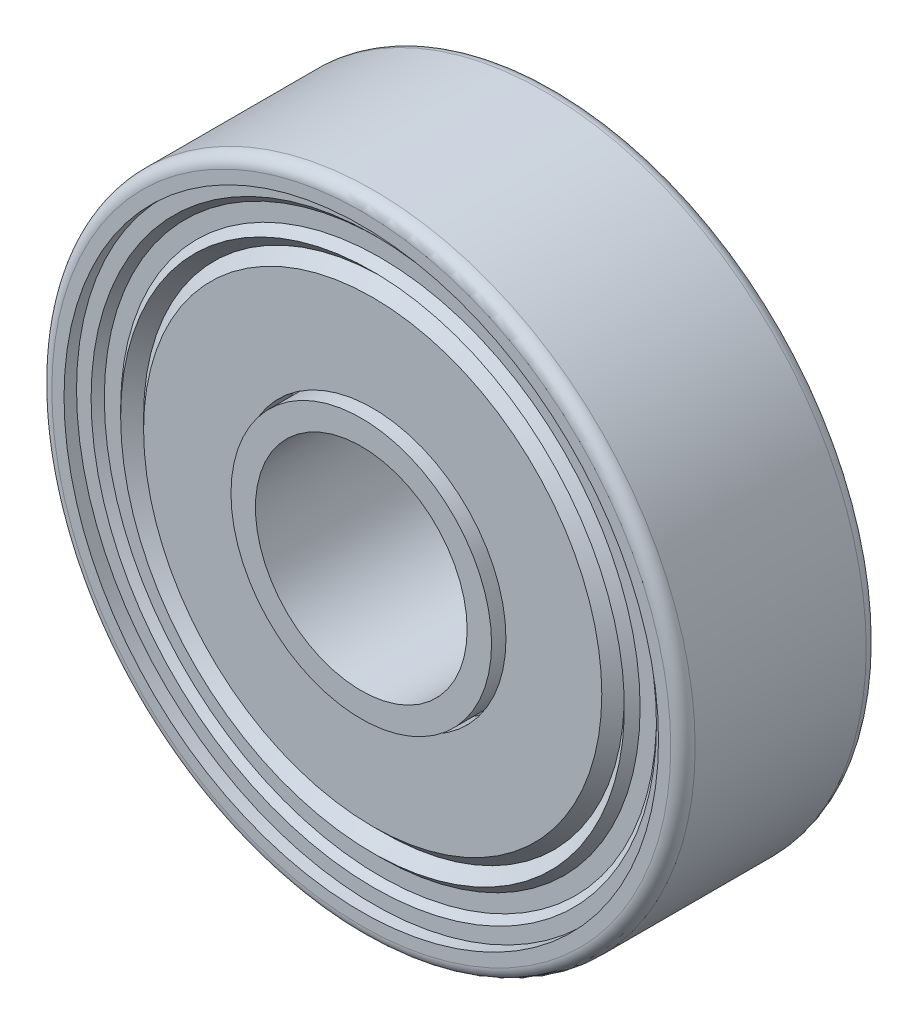
from build123d import *

# Parameters (mm, degrees)
SKETCH1_R           = 7.9
SKETCH1_R_2         = 2.6
BOSS_EXTRUDE1_DEPTH = 4.8
FILLET1_R           = 0.3


with BuildPart() as part:
    # Sketch1 → Boss-Extrude1 (new body)
    with BuildSketch(Plane.XY):
        Circle(SKETCH1_R)
        Circle(SKETCH1_R_2, mode=Mode.SUBTRACT)
    extrude(amount=BOSS_EXTRUDE1_DEPTH)

    # Sketch2 → Cut-Revolve1 (revolve, cut)
    with BuildSketch(Plane(origin=(0, 0, 0), x_dir=(0, 0, -1), z_dir=(1, 0, 0)), mode=Mode.PRIVATE) as cut_revolve1_sk:
        Polygon((-5.02377309, 7.3), (-4.492956226, 7.3), (-4.492956226, 6.942652627), (-4.330576131, 6.780272532), (-4.330576131, 6.378958324), (-4.524078417, 6.185456038), (-4.242386553, 5.903764175), (-4.519629847, 5.626520881), (-4.519629847, 3.272939667), (-3.81743033, 3.272939667), (-3.81743033, 3.2), (-4.879732163, 3.2), (-4.879732163, 0), (-5.869193326, 0), (-5.869193326, 7.3), align=None)
    cut_revolve1 = revolve(cut_revolve1_sk.sketch.rotate(Axis((0, 0, 4.879732163), (0, 0, 1)), 90), axis=Axis((0, 0, 4.879732163), (0, 0, 1)), mode=Mode.SUBTRACT)

    # Mirror1: Cut-Revolve1 across plane
    add(cut_revolve1.mirror(Plane.XY.offset(2.4)), mode=Mode.SUBTRACT)

    # Fillet1
    fillet1_edges = [part.edges().sort_by_distance(p)[0] for p in [
        (-7.9, 0, 0),
        (-7.9, 0, 4.8),
    ]]
    fillet(fillet1_edges, radius=FILLET1_R)


solid = part.part
